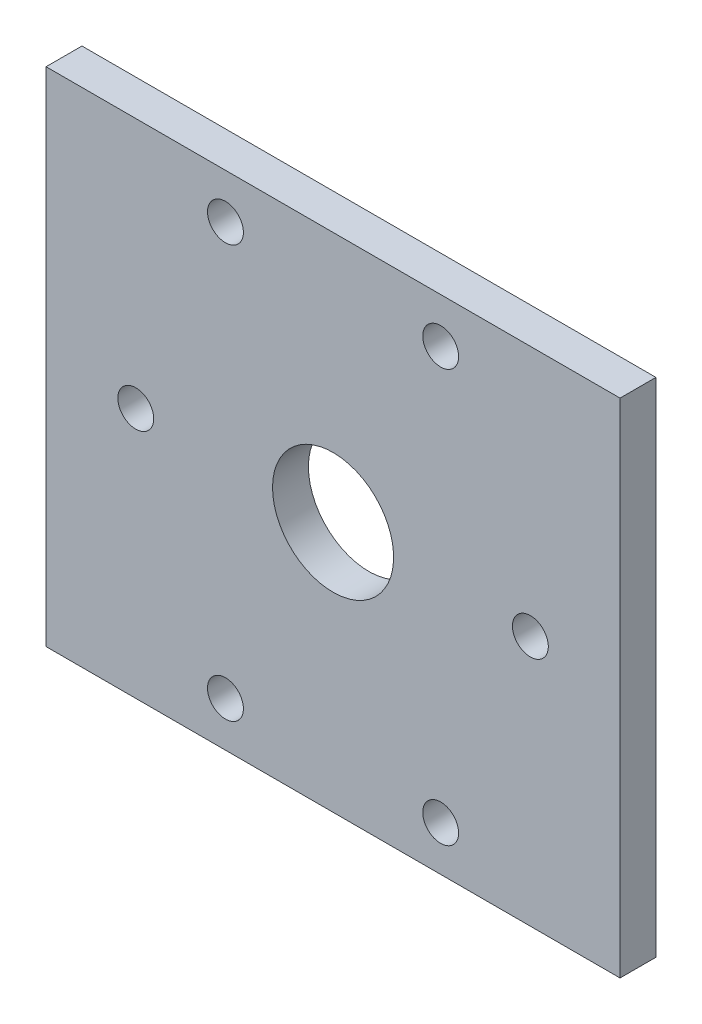
from build123d import *

# Parameters (mm, degrees)
SKETCH1_W           = 64
SKETCH1_H           = 56
SKETCH1_R           = 2
BOSS_EXTRUDE1_DEPTH = 4
SKETCH2_R           = 6.75
CUT_EXTRUDE1_DEPTH  = 4
SKETCH3_R           = 2
CUT_EXTRUDE2_DEPTH  = 4


with BuildPart() as part:
    # Sketch1 → Boss-Extrude1 (new body)
    with BuildSketch(Plane.XY):
        Rectangle(SKETCH1_W, SKETCH1_H)
        with Locations((-12, 23)):
            Circle(SKETCH1_R, mode=Mode.SUBTRACT)
        with Locations((12, 23)):
            Circle(SKETCH1_R, mode=Mode.SUBTRACT)
        with Locations((-12, -23)):
            Circle(SKETCH1_R, mode=Mode.SUBTRACT)
        with Locations((12, -23)):
            Circle(SKETCH1_R, mode=Mode.SUBTRACT)
    extrude(amount=BOSS_EXTRUDE1_DEPTH)

    # Sketch2 → Cut-Extrude1 (cut)
    with BuildSketch(Plane(origin=(0, 0, 0), x_dir=(-1, 0, 0), z_dir=(0, 0, -1))):
        Circle(SKETCH2_R)
    extrude(amount=-CUT_EXTRUDE1_DEPTH, mode=Mode.SUBTRACT)

    # Sketch3 → Cut-Extrude2 (cut)
    with BuildSketch(Plane(origin=(0, 0, 0), x_dir=(-1, 0, 0), z_dir=(0, 0, -1))):
        with Locations((-22, 0)):
            Circle(SKETCH3_R)
        with Locations((22, 0)):
            Circle(SKETCH3_R)
    extrude(amount=-CUT_EXTRUDE2_DEPTH, mode=Mode.SUBTRACT)


solid = part.part
